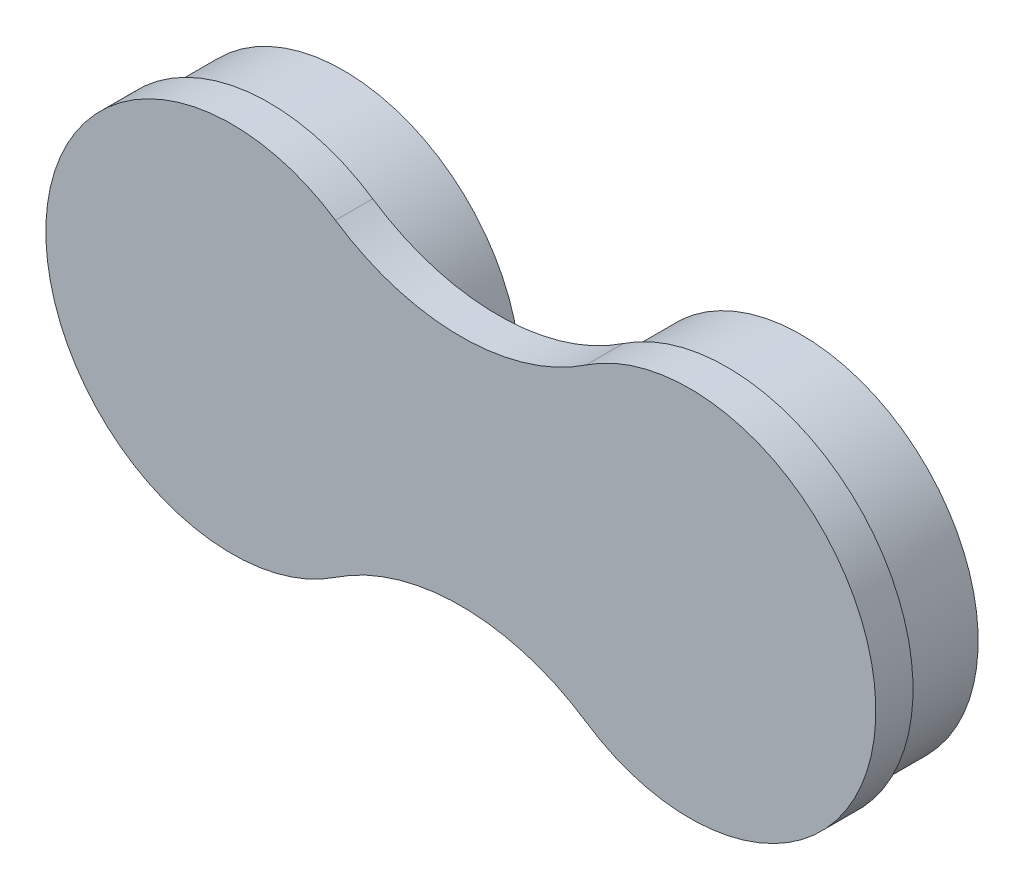
from build123d import *

# Parameters (mm, degrees)
SKETCH1_R             = 4.75
BOSS_EXTRUDE1_DEPTH   = 2
BOSS_EXTRUDE1_2_DEPTH = 2
SKETCH2_R             = 2.25
CUT_EXTRUDE1_DEPTH    = 2
SKETCH2_4_R           = 2.25
CUT_EXTRUDE2_DEPTH    = 2
BOSS_EXTRUDE2_DEPTH   = 1


with BuildPart() as part:
    # Sketch1 → Boss-Extrude1 (new body)
    with BuildSketch(Plane.XY):
        with Locations((-6.15, 0)):
            Circle(SKETCH1_R)
    extrude(amount=BOSS_EXTRUDE1_DEPTH)

    # Sketch2 → Cut-Extrude1 (cut)
    with BuildSketch(Plane.XY.offset(2)):
        with Locations((-6.15, 0)):
            Circle(SKETCH2_R)
    extrude(amount=-CUT_EXTRUDE1_DEPTH, mode=Mode.SUBTRACT)



with BuildPart() as body_2:
    # Sketch1 → Boss-Extrude1 2 (new body)
    with BuildSketch(Plane.XY):
        with Locations((6.15, 0)):
            Circle(SKETCH1_R)
    extrude(amount=BOSS_EXTRUDE1_2_DEPTH)

    # Sketch2<4> → Cut-Extrude2 (cut)
    with BuildSketch(Plane.XY.offset(2)):
        with Locations((6.15, 0)):
            Circle(SKETCH2_4_R)
    extrude(amount=-CUT_EXTRUDE2_DEPTH, mode=Mode.SUBTRACT)


with BuildPart() as part_1:
    add(part.part)

    add(body_2.part)  # Boss-Extrude2 merges body 2
    # Sketch4 → Boss-Extrude2 (add)
    with BuildSketch(Plane.XY.offset(2)):
        with BuildLine():
            ThreePointArc((-3.367629676, 4.1543249), (-11.15, 3.6455e-05), (-3.367690254, -4.154365473))
            ThreePointArc((-3.367690254, -4.154365473), (0, -3.130814748), (3.367690254, -4.154365473))
            ThreePointArc((3.367690254, -4.154365473), (11.15, 3.6455e-05), (3.367629676, 4.1543249))
            ThreePointArc((3.367629676, 4.1543249), (0, 3.130765766), (-3.367629676, 4.1543249))
        make_face()
    extrude(amount=BOSS_EXTRUDE2_DEPTH)


solid = part_1.part
